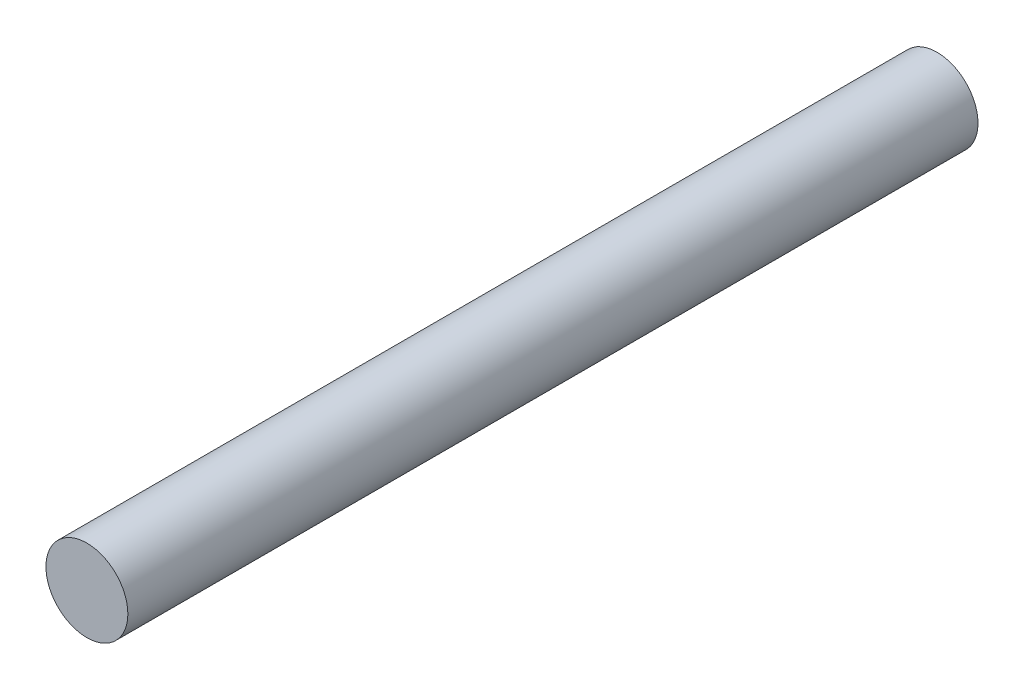
from build123d import *

# Parameters (mm, degrees)
SKETCH1_R           = 2
BOSS_EXTRUDE1_DEPTH = 41.5


with BuildPart() as part:
    # Sketch1 → Boss-Extrude1 (new body)
    with BuildSketch(Plane.XY):
        Circle(SKETCH1_R)
    extrude(amount=BOSS_EXTRUDE1_DEPTH)


solid = part.part
